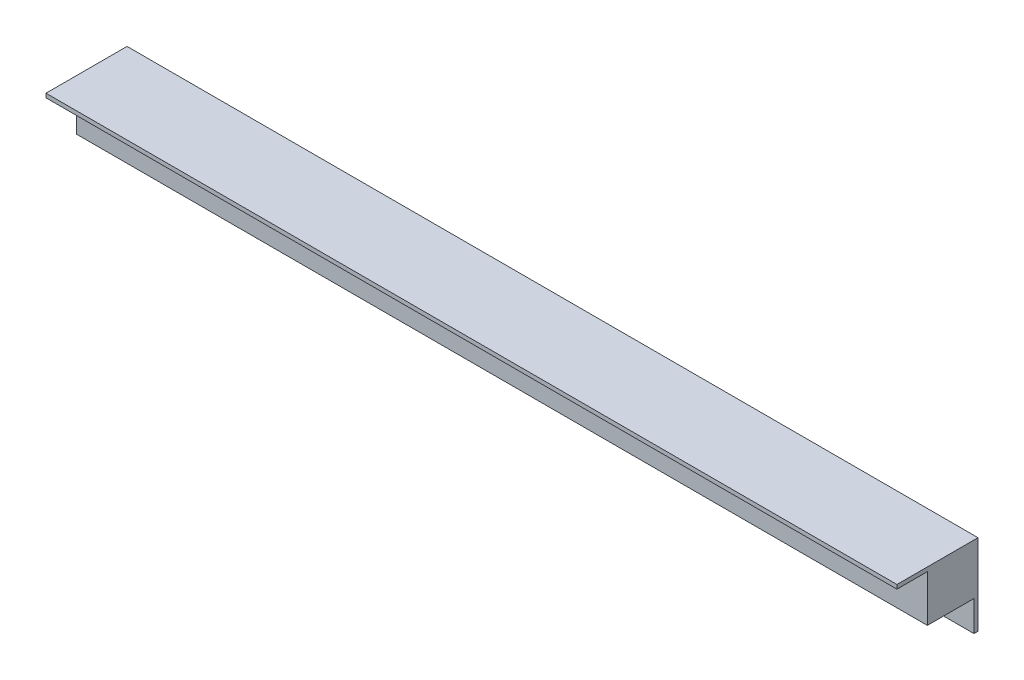
from build123d import *

# Parameters (mm, degrees)
SKETCH2_W           = 420
SKETCH2_H           = 40
BOSS_EXTRUDE1_DEPTH = 40
SKETCH3_W           = 38
SKETCH3_H           = 38
CUT_EXTRUDE1_DEPTH  = 1000
SKETCH4_W           = 23
SKETCH4_H           = 23
BOSS_EXTRUDE2_DEPTH = 420


with BuildPart() as part:
    # Sketch2 → Boss-Extrude1 (new body)
    with BuildSketch(Plane.XY):
        with Locations((-6.593186373, 82.705410822)):
            Rectangle(SKETCH2_W, SKETCH2_H)
    extrude(amount=BOSS_EXTRUDE1_DEPTH)

    # Sketch3 → Cut-Extrude1 (cut)
    with BuildSketch(Plane.ZY.offset(216.593186373)):
        with Locations((21, 81.705410822)):
            Rectangle(SKETCH3_W, SKETCH3_H)
    extrude(amount=-CUT_EXTRUDE1_DEPTH, mode=Mode.SUBTRACT)

    # Sketch4 → Boss-Extrude2 (add)
    with BuildSketch(Plane.ZY.offset(216.593186373)):
        with Locations((13.5, 89.205410822)):
            Rectangle(SKETCH4_W, SKETCH4_H)
    extrude(amount=-BOSS_EXTRUDE2_DEPTH)


solid = part.part
